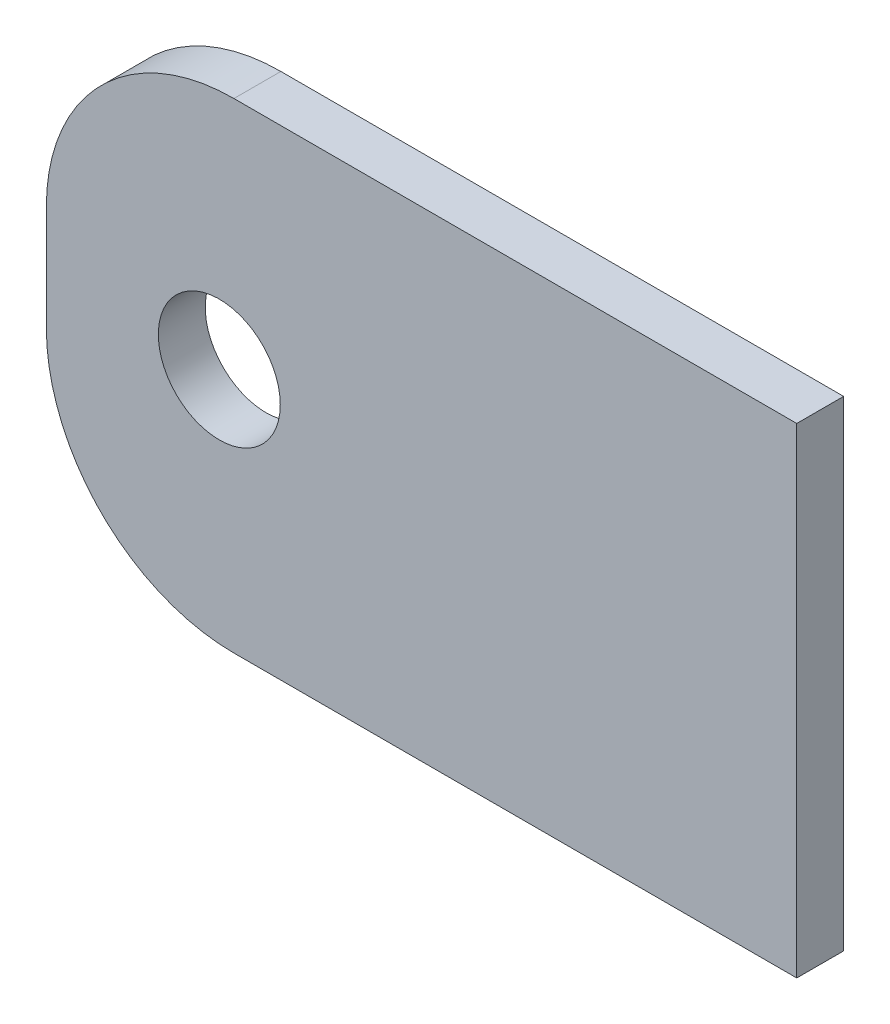
from build123d import *

# Parameters (mm, degrees)
SKETCH2_R           = 3.25
BOSS_EXTRUDE1_DEPTH = 2.5


with BuildPart() as part:
    # Sketch2 → Boss-Extrude1 (new body)
    with BuildSketch(Plane.XY):
        with BuildLine():
            Line((-11.218756856, 3.092102377), (18.781243144, 3.092102377))
            Line((18.781243144, 3.092102377), (18.781243144, -22.507897623))
            Line((18.781243144, -22.507897623), (-11.218756856, -22.507897623))
            ThreePointArc((-11.218756856, -22.507897623), (-18.289824667, -19.578965435), (-21.218756856, -12.507897623))
            Line((-21.218756856, -12.507897623), (-21.218756856, -6.907897623))
            ThreePointArc((-21.218756856, -6.907897623), (-18.289824667, 0.163170188), (-11.218756856, 3.092102377))
        make_face()
        with Locations((-12, -9.807897623)):
            Circle(SKETCH2_R, mode=Mode.SUBTRACT)
    extrude(amount=BOSS_EXTRUDE1_DEPTH)


solid = part.part
